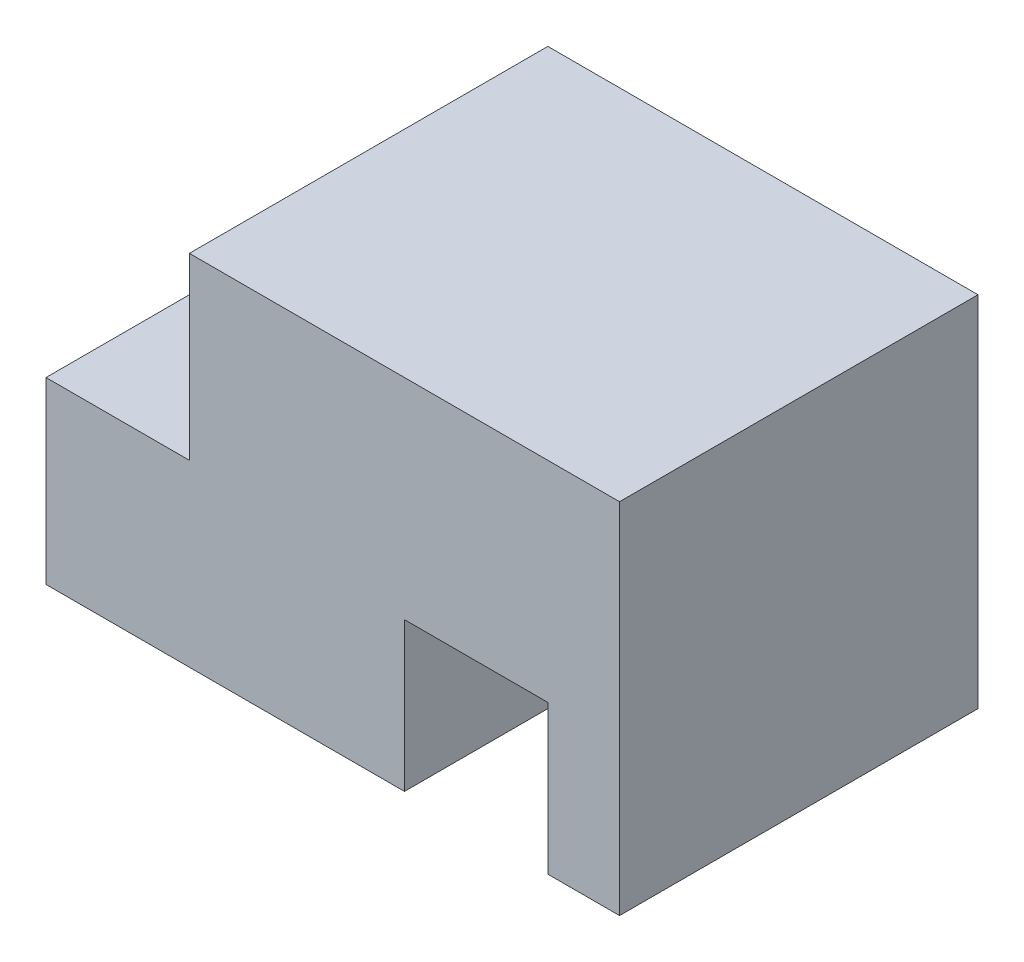
from build123d import *

# Parameters (mm, degrees)
Y_KSEKLIK_EKSTR_ZYON1_DEPTH = 1270


with BuildPart() as part:
    # Çizim1 → Yükseklik-Ekstrüzyon1 (new body)
    with BuildSketch(Plane.XY):
        Polygon((-1241.758760108, -670.943396226), (-987.758760108, -670.943396226), (-987.758760108, -570.301886792), (-987.758760108, 599.056603774), (-2511.758760108, 599.056603774), (-2511.758760108, -35.943396226), (-3019.758760108, -35.943396226), (-3019.758760108, -670.943396226), (-1749.758760108, -670.943396226), (-1749.758760108, -143.773584906), (-1241.758760108, -143.773584906), align=None)
    extrude(amount=Y_KSEKLIK_EKSTR_ZYON1_DEPTH)


solid = part.part
